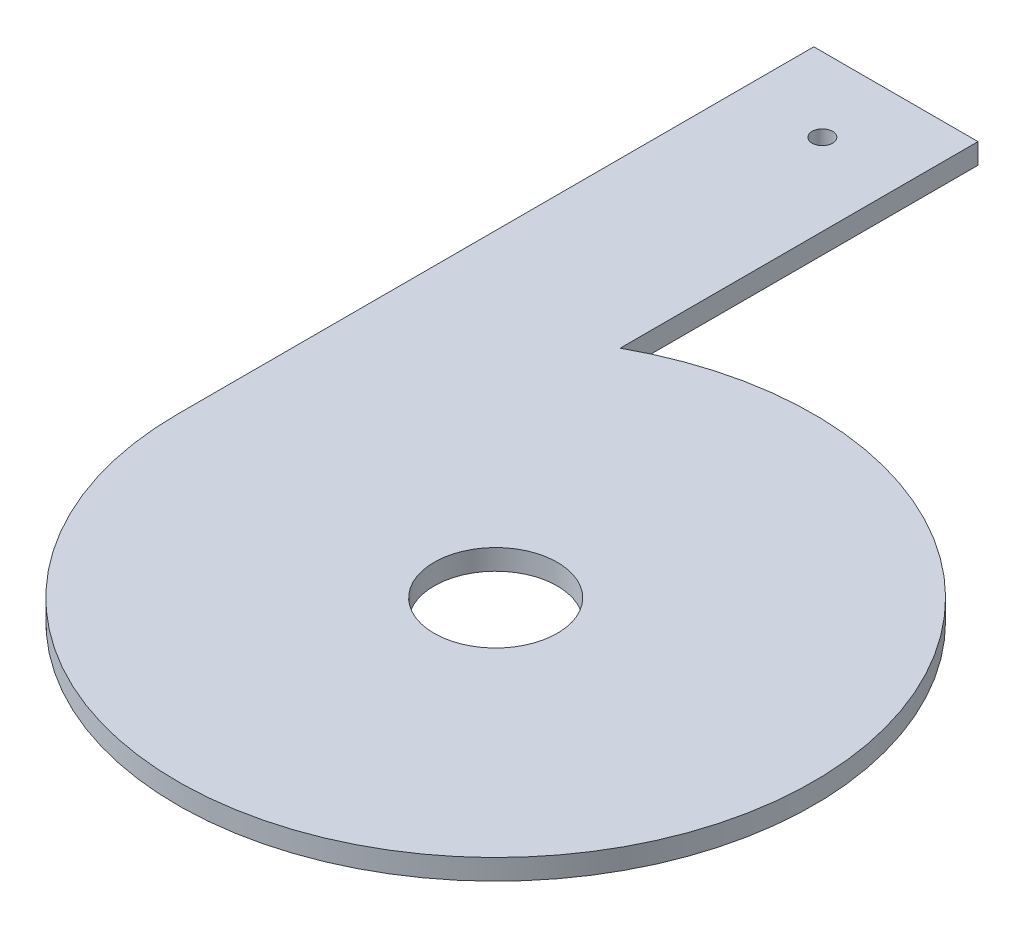
from build123d import *

# Parameters (mm, degrees)
SKETCH1_R           = 31
BOSS_EXTRUDE1_DEPTH = 2
SKETCH2_R           = 6
CUT_EXTRUDE1_DEPTH  = 2
SKETCH3_W           = 16
SKETCH3_H           = 62
BOSS_EXTRUDE2_DEPTH = 2
CUT_EXTRUDE2_REACH  = 71.347
SKETCH11_R          = 1


with BuildPart() as part:
    # Sketch1 → Boss-Extrude1 (new body)
    with BuildSketch(Plane(origin=(0, 0, 0), x_dir=(1, 0, 0), z_dir=(0, 1, 0))):
        with Locations(Location((0, 0, 0), (0, 0, 270))):
            Circle(SKETCH1_R)
    extrude(amount=BOSS_EXTRUDE1_DEPTH)

    # Sketch2 → Cut-Extrude1 (cut)
    with BuildSketch(Plane(origin=(0, 2, 0), x_dir=(1, 0, 0), z_dir=(0, 1, 0))):
        with Locations(Location((0, 0, 0), (0, 0, 270))):
            Circle(SKETCH2_R)
    extrude(amount=-CUT_EXTRUDE1_DEPTH, mode=Mode.SUBTRACT)

    # Sketch3 → Boss-Extrude2 (add)
    with BuildSketch(Plane(origin=(0, 2, 0), x_dir=(1, 0, 0), z_dir=(0, 1, 0))):
        with Locations((-23, 31)):
            Rectangle(SKETCH3_W, SKETCH3_H)
    extrude(amount=-BOSS_EXTRUDE2_DEPTH)

    # Sketch11 → Cut-Extrude2 (cut, up to next)
    with BuildSketch(Plane(origin=(0, 2, 0), x_dir=(1, 0, 0), z_dir=(0, 1, 0)), mode=Mode.PRIVATE) as cut_extrude2_sk1:
        with Locations(Location((-22.95, 54.78, 0), (0, 0, 270))):
            Circle(SKETCH11_R)
    cut_extrude2_tool1 = extrude(cut_extrude2_sk1.sketch, amount=-CUT_EXTRUDE2_REACH, mode=Mode.PRIVATE) & part.part
    add(cut_extrude2_tool1.solids().sort_by_distance((-22.95, 2, -54.78))[0], mode=Mode.SUBTRACT)


solid = part.part
